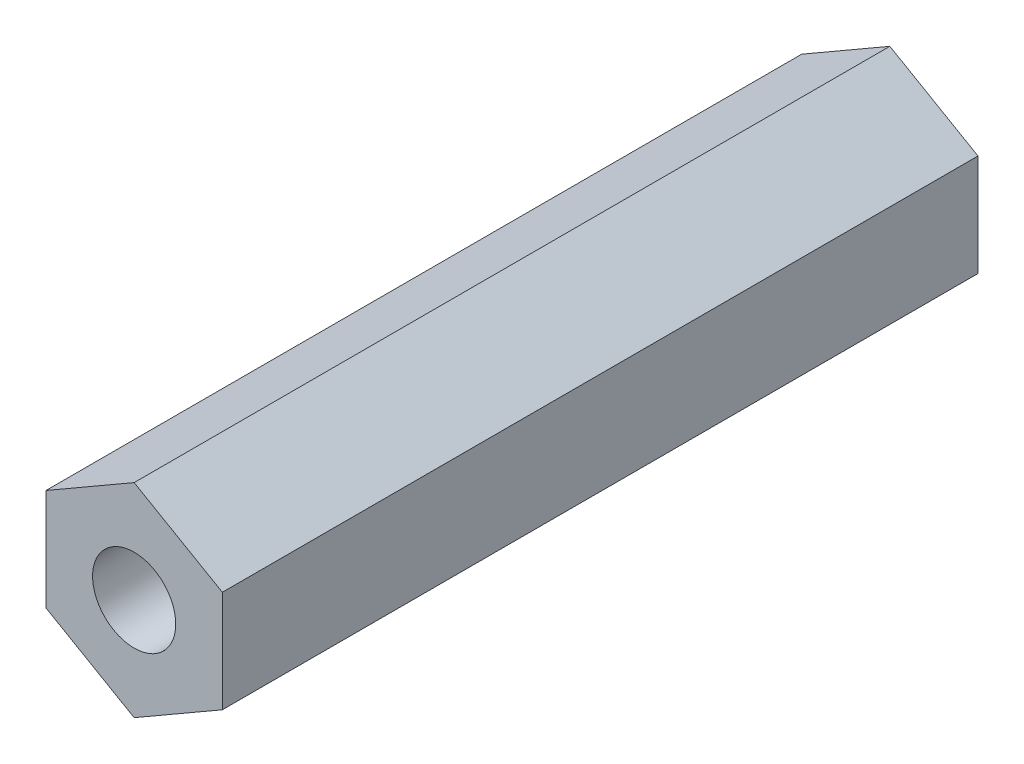
from build123d import *

# Parameters (mm, degrees)
PROFILE_1_R        = 1.65
HEX_STANDOFF_DEPTH = 30


with BuildPart() as part:
    # Profile_1 → Hex_standoff (new body)
    with BuildSketch(Plane.XY):
        Polygon((3.5, 2.020725942), (0, 4.041451884), (-3.5, 2.020725942), (-3.5, -2.020725942), (0, -4.041451884), (3.5, -2.020725942), align=None)
        Circle(PROFILE_1_R, mode=Mode.SUBTRACT)
    extrude(amount=HEX_STANDOFF_DEPTH)


solid = part.part
